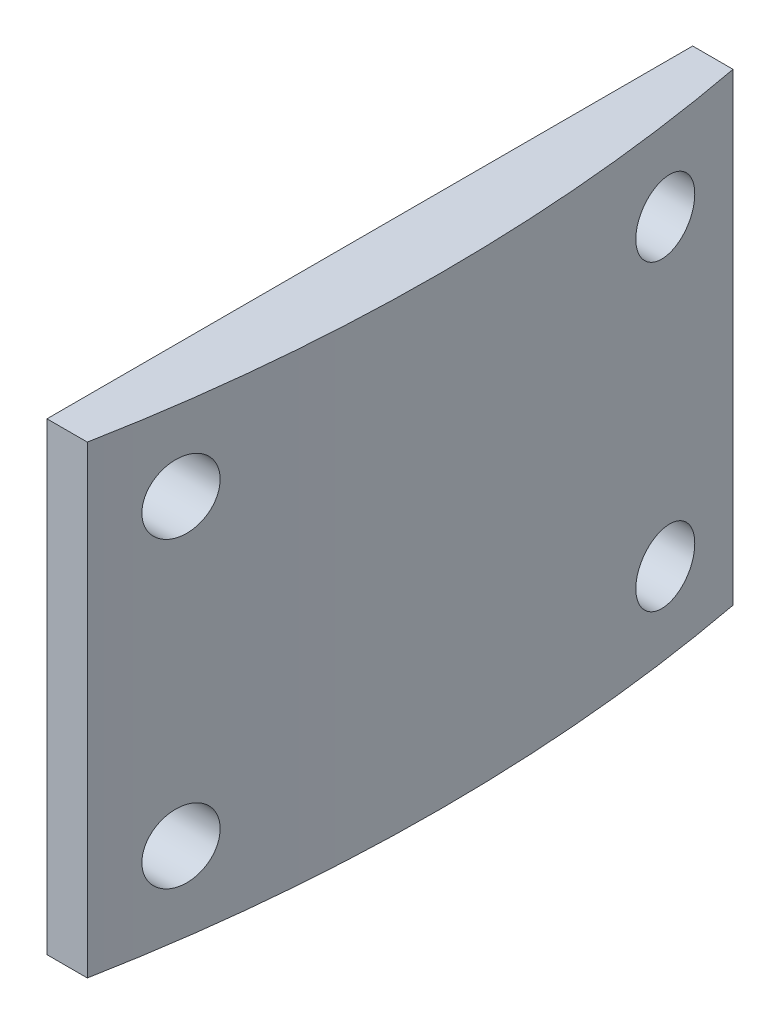
from build123d import *

# Parameters (mm, degrees)
EXTRUDE_1_DEPTH     = 23
CUT_EXTRUDE_1_DEPTH = 29.235799215


with BuildPart() as part:
    # Эскиз1 → Бобышка-Вытянуть1 (new body)
    with BuildSketch(Plane(origin=(0, 0, 0), x_dir=(1, 0, 0), z_dir=(0, 1, 0))):
        with BuildLine():
            Line((-1.501479303, 16), (-3.501479303, 16))
            Line((-3.501479303, 16), (-3.501479303, -16))
            Line((-3.501479303, -16), (-1.501479303, -16))
            ThreePointArc((-1.501479303, -16), (0, 0), (-1.501479303, 16))
        make_face()
    extrude(amount=EXTRUDE_1_DEPTH)

    # Эскиз2 → Вырез-Вытянуть1 (cut, through all)
    with BuildSketch(Plane.ZY.offset(3.501479303)):
        with BuildLine():
            ThreePointArc((-10.3, 4), (-10.797918472, 5.202081528), (-12, 5.7))
            Line((-12, 5.7), (-12, 4))
            Line((-12, 4), (-10.3, 4))
        make_face()
        with BuildLine():
            Line((-12, 4), (-12, 5.7))
            ThreePointArc((-12, 5.7), (-13.202081528, 2.797918472), (-10.3, 4))
            Line((-10.3, 4), (-12, 4))
        make_face()
        with BuildLine():
            Line((-12, 17.3), (-12, 19))
            Line((-12, 19), (-10.3, 19))
            ThreePointArc((-10.3, 19), (-13.202081528, 20.202081528), (-12, 17.3))
        make_face()
        with BuildLine():
            Line((-10.3, 19), (-12, 19))
            Line((-12, 19), (-12, 17.3))
            ThreePointArc((-12, 17.3), (-10.797918472, 17.797918472), (-10.3, 19))
        make_face()
        with BuildLine():
            ThreePointArc((13.7, 19), (12, 20.7), (10.3, 19))
            Line((10.3, 19), (12, 19))
            Line((12, 19), (12, 17.3))
            ThreePointArc((12, 17.3), (13.202081528, 17.797918472), (13.7, 19))
        make_face()
        with BuildLine():
            Line((12, 19), (10.3, 19))
            ThreePointArc((10.3, 19), (10.797918472, 17.797918472), (12, 17.3))
            Line((12, 17.3), (12, 19))
        make_face()
        with BuildLine():
            ThreePointArc((13.7, 4), (13.202081528, 5.202081528), (12, 5.7))
            Line((12, 5.7), (12, 4))
            Line((12, 4), (10.3, 4))
            ThreePointArc((10.3, 4), (12, 2.3), (13.7, 4))
        make_face()
        with BuildLine():
            Line((12, 4), (12, 5.7))
            ThreePointArc((12, 5.7), (10.797918472, 5.202081528), (10.3, 4))
            Line((10.3, 4), (12, 4))
        make_face()
    extrude(amount=-CUT_EXTRUDE_1_DEPTH, mode=Mode.SUBTRACT)


solid = part.part
